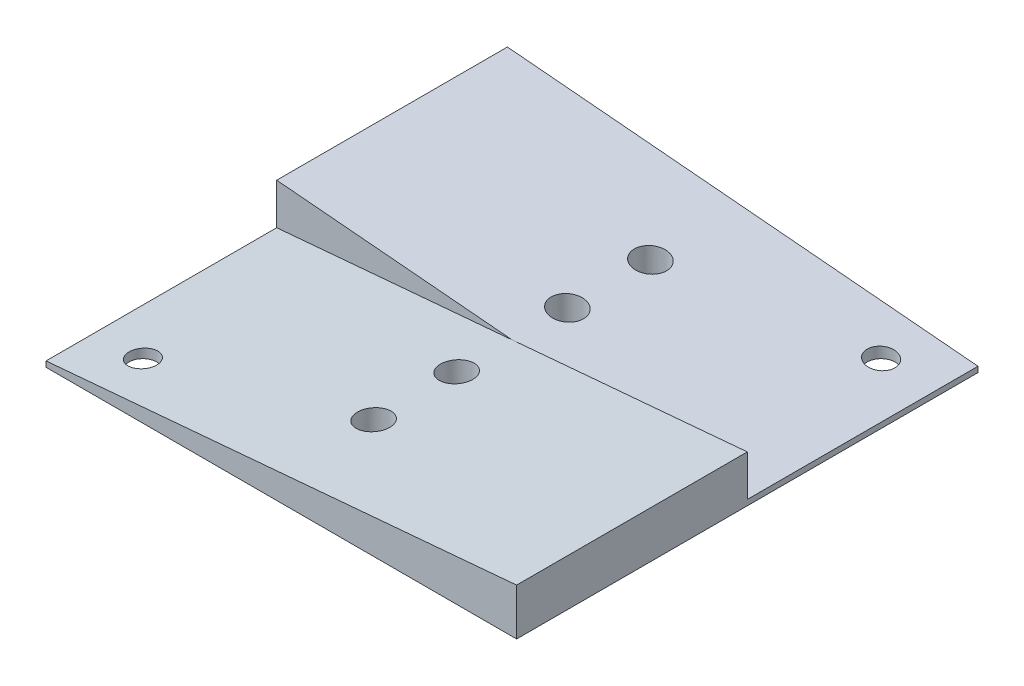
from build123d import *

# Parameters (mm, degrees)
ESBO_O2_W                  = 51
ESBO_O2_H                  = 50
RESSALTO_EXTRUS_O2_DEPTH   = 6
CORTE_EXTRUS_O1_DEPTH      = 25
CORTE_EXTRUS_O3_DEPTH      = 25
CORTE_EXTRUS_O5_DEPTH      = 37.067617785
CORTE_EXTRUS_O5_DEPTH_BACK = 37.067617785
ESBO_O5_R                  = 1.75
ESBO_O7_R                  = 1.5
CORTE_EXTRUS_O6_DEPTH      = 37.067617785


with BuildPart() as part:
    # Esboço2 → Ressalto-extrusão2 (new body)
    with BuildSketch(Plane(origin=(0, 0, 0), x_dir=(1, 0, 0), z_dir=(0, 1, 0))):
        Rectangle(ESBO_O2_W, ESBO_O2_H)
    extrude(amount=RESSALTO_EXTRUS_O2_DEPTH)

    # Esboço3 → Corte-extrusão1 (cut)
    with BuildSketch(Plane.XY.offset(25)):
        Polygon((-25.5, 0.6), (25.5, 5.06192184), (25.5, 6), (-25.5, 6), align=None)
    extrude(amount=-CORTE_EXTRUS_O1_DEPTH, mode=Mode.SUBTRACT)

    # Esboço4 → Corte-extrusão3 (cut)
    with BuildSketch(Plane(origin=(0, 0, -25), x_dir=(-1, 0, 0), z_dir=(0, 0, -1))):
        Polygon((-25.5, 0.6), (25.5, 5.06192184), (25.5, 6), (-25.5, 6), align=None)
    extrude(amount=-CORTE_EXTRUS_O3_DEPTH, mode=Mode.SUBTRACT)

    # Esboço5 → Corte-extrusão5 (cut, two sides: drawn at the far end of the back side and taken through both)
    with BuildSketch(Plane.XZ.offset(-CORTE_EXTRUS_O5_DEPTH_BACK)):
        with Locations((0, 6)):
            Circle(ESBO_O5_R)
        with Locations((0, 15)):
            Circle(ESBO_O5_R)
        with Locations((0, -15)):
            Circle(ESBO_O5_R)
        with Locations((0, -6)):
            Circle(ESBO_O5_R)
    extrude(amount=CORTE_EXTRUS_O5_DEPTH + CORTE_EXTRUS_O5_DEPTH_BACK, mode=Mode.SUBTRACT)

    # Esboço7 → Corte-extrusão6 (cut, through all)
    with BuildSketch(Plane.XZ):
        with Locations((-20, 20)):
            Circle(ESBO_O7_R)
        with Locations((20, -20)):
            Circle(ESBO_O7_R)
    extrude(amount=-CORTE_EXTRUS_O6_DEPTH, mode=Mode.SUBTRACT)


solid = part.part
